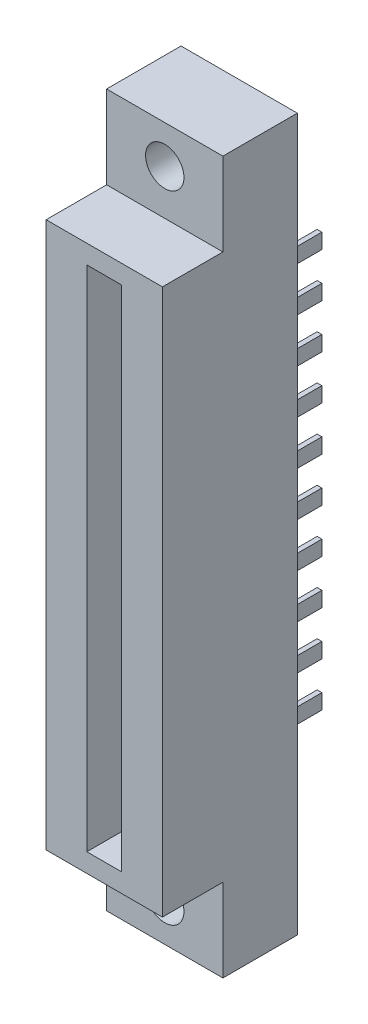
from build123d import *

# Parameters (mm, degrees)
SKETCH_1_W          = 10
SKETCH_1_H          = 61.2
EXTRUDE_1_DEPTH     = 6.4
SKETCH_2_W          = 10
SKETCH_2_H          = 46.93
EXTRUDE_2_DEPTH     = 5.2
SKETCH_3_R          = 1.65
CUT_EXTRUDE_1_DEPTH = 15.3
SKETCH_4_W          = 0.41
SKETCH_4_H          = 1.3
EXTRUDE_3_DEPTH     = 5
SKETCH_5_W          = 3
SKETCH_5_H          = 43.7
CUT_EXTRUDE_2_DEPTH = 8


with BuildPart() as part:
    # 草图1 → 拉伸1 (new body)
    with BuildSketch(Plane.XY):
        Rectangle(SKETCH_1_W, SKETCH_1_H)
    extrude(amount=EXTRUDE_1_DEPTH)

    # 草图2 → 拉伸2 (add)
    with BuildSketch(Plane.XY.offset(6.4)):
        Rectangle(SKETCH_2_W, SKETCH_2_H)
    extrude(amount=EXTRUDE_2_DEPTH)

    # 草图3 → 切除-拉伸1 (cut)
    with BuildSketch(Plane.XY.offset(6.4)):
        with Locations((0, 27.335)):
            Circle(SKETCH_3_R)
        with Locations((0, -27.335)):
            Circle(SKETCH_3_R)
    extrude(amount=-CUT_EXTRUDE_1_DEPTH, mode=Mode.SUBTRACT)

    # 草图4 → 拉伸3 (add)
    with BuildSketch(Plane(origin=(0, 0, 0), x_dir=(-1, 0, 0), z_dir=(0, 0, -1))):
        with Locations((-1.905, 1.905)):
            Rectangle(SKETCH_4_W, SKETCH_4_H)
        with Locations((1.905, 1.905)):
            Rectangle(SKETCH_4_W, SKETCH_4_H)
        with Locations((-1.905, 5.715)):
            Rectangle(SKETCH_4_W, SKETCH_4_H)
        with Locations((1.905, 5.715)):
            Rectangle(SKETCH_4_W, SKETCH_4_H)
        with Locations((-1.905, 9.525)):
            Rectangle(SKETCH_4_W, SKETCH_4_H)
        with Locations((1.905, 9.525)):
            Rectangle(SKETCH_4_W, SKETCH_4_H)
        with Locations((-1.905, 13.335)):
            Rectangle(SKETCH_4_W, SKETCH_4_H)
        with Locations((1.905, 13.335)):
            Rectangle(SKETCH_4_W, SKETCH_4_H)
        with Locations((-1.905, 17.145)):
            Rectangle(SKETCH_4_W, SKETCH_4_H)
        with Locations((1.905, 17.145)):
            Rectangle(SKETCH_4_W, SKETCH_4_H)
        with Locations((-1.905, -1.905)):
            Rectangle(SKETCH_4_W, SKETCH_4_H)
        with Locations((1.905, -1.905)):
            Rectangle(SKETCH_4_W, SKETCH_4_H)
        with Locations((-1.905, -5.715)):
            Rectangle(SKETCH_4_W, SKETCH_4_H)
        with Locations((1.905, -5.715)):
            Rectangle(SKETCH_4_W, SKETCH_4_H)
        with Locations((-1.905, -9.525)):
            Rectangle(SKETCH_4_W, SKETCH_4_H)
        with Locations((1.905, -9.525)):
            Rectangle(SKETCH_4_W, SKETCH_4_H)
        with Locations((-1.905, -13.335)):
            Rectangle(SKETCH_4_W, SKETCH_4_H)
        with Locations((1.905, -13.335)):
            Rectangle(SKETCH_4_W, SKETCH_4_H)
        with Locations((-1.905, -17.145)):
            Rectangle(SKETCH_4_W, SKETCH_4_H)
        with Locations((1.905, -17.145)):
            Rectangle(SKETCH_4_W, SKETCH_4_H)
    extrude(amount=EXTRUDE_3_DEPTH)

    # 草图5 → 切除-拉伸2 (cut)
    with BuildSketch(Plane.XY.offset(11.6)):
        Rectangle(SKETCH_5_W, SKETCH_5_H)
    extrude(amount=-CUT_EXTRUDE_2_DEPTH, mode=Mode.SUBTRACT)


solid = part.part
